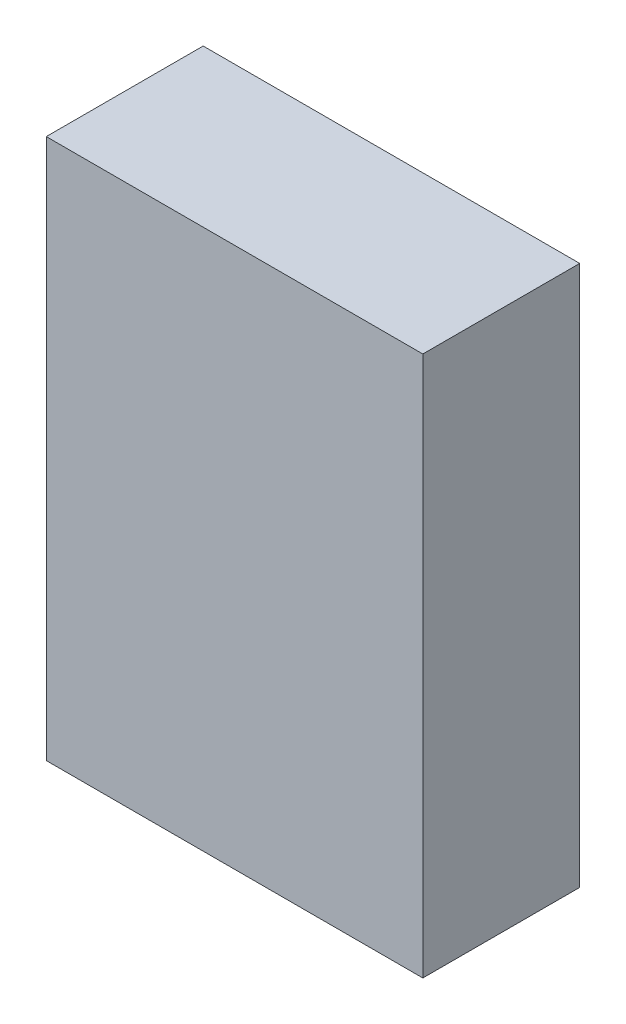
from build123d import *

# Parameters (mm, degrees)
SKETCH_1_W              = 1.08
SKETCH_1_H              = 1.55
COMPONENT_OUTLINE_DEPTH = 0.45


with BuildPart() as part:
    # 草图1 → Component_Outline (new body)
    with BuildSketch(Plane.XY):
        Rectangle(SKETCH_1_W, SKETCH_1_H)
    extrude(amount=COMPONENT_OUTLINE_DEPTH)


solid = part.part
